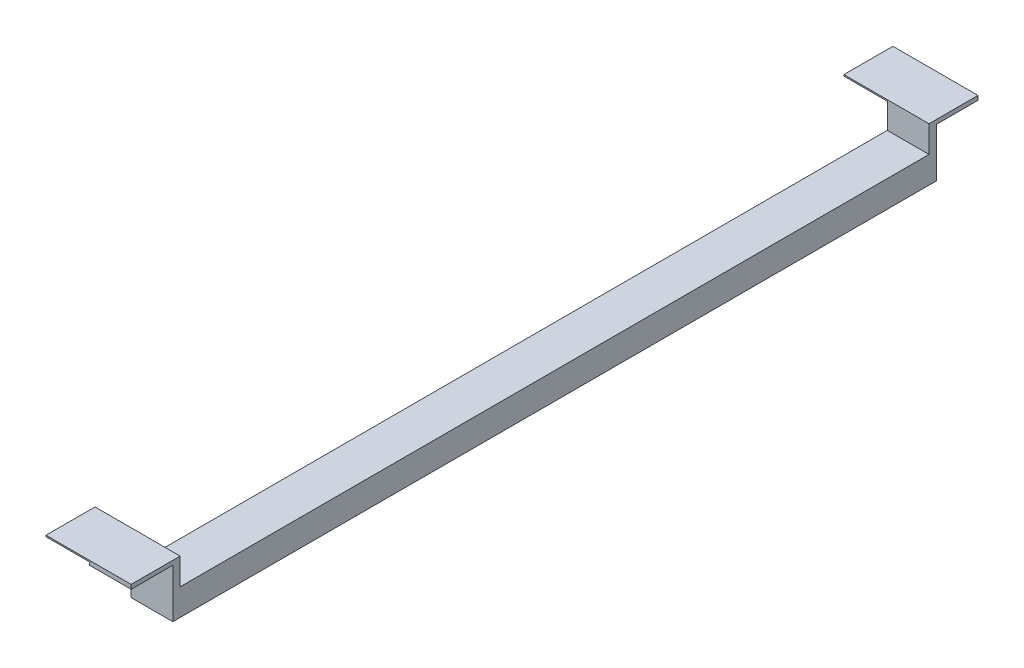
from build123d import *

# Parameters (mm, degrees)
SKETCH_2_W      = 98
SKETCH_2_H      = 98
EXTRUDE_1_DEPTH = 10
SKETCH_3_W      = 98
SKETCH_3_H      = 125
EXTRUDE_2_DEPTH = 10
SKETCH_4_W      = 98
SKETCH_4_H      = 62.5
EXTRUDE_3_DEPTH = 886.75
SKETCH_5_W      = 98
SKETCH_5_H      = 62.5
EXTRUDE_4_DEPTH = 7.1
SKETCH_6_W      = 98
SKETCH_6_H      = 62.5
EXTRUDE_5_DEPTH = 7.1
SKETCH_9_W      = 115.1
SKETCH_9_H      = 3.2
EXTRUDE_6_DEPTH = 102


with BuildPart() as part:
    # 草图2 → 凸台-拉伸1 (new body)
    with BuildSketch(Plane(origin=(0, 0, 0), x_dir=(1, 0, 0), z_dir=(0, 1, 0))):
        with Locations((34.507061985, 30.744472309)):
            Rectangle(SKETCH_2_W, SKETCH_2_H)
    extrude(amount=EXTRUDE_1_DEPTH)

    # 草图3 → 凸台-拉伸2 (add)
    with BuildSketch(Plane.XY.offset(18.255527691)):
        with Locations((34.507061985, -52.5)):
            Rectangle(SKETCH_3_W, SKETCH_3_H)
    extrude(amount=EXTRUDE_2_DEPTH)

    # 草图4 → 凸台-拉伸3 (add)
    with BuildSketch(Plane.XY.offset(28.255527691)):
        with Locations((34.507061985, -83.75)):
            Rectangle(SKETCH_4_W, SKETCH_4_H)
    extrude(amount=EXTRUDE_3_DEPTH)

    # 镜向4: part across plane


with BuildPart() as part_1:
    add(part.part)
    add(part.part.mirror(Plane.XY.offset(915.005527691)))

    # 草图5 → 凸台-拉伸4 (add)
    with BuildSketch(Plane.XY.offset(28.255527691)):
        with Locations((34.507061985, -21.25)):
            Rectangle(SKETCH_5_W, SKETCH_5_H)
    extrude(amount=EXTRUDE_4_DEPTH)

    # 草图6 → 凸台-拉伸5 (add)
    with BuildSketch(Plane(origin=(0, 0, 1801.755527691), x_dir=(-1, 0, 0), z_dir=(0, 0, -1))):
        with Locations((-34.507061985, -21.25)):
            Rectangle(SKETCH_6_W, SKETCH_6_H)
    extrude(amount=EXTRUDE_5_DEPTH)

    # 草图9 → 凸台-拉伸6 (add)
    with BuildSketch(Plane.ZY.offset(14.492938015)):
        with Locations((-22.194472309, 8.4)):
            Rectangle(SKETCH_9_W, SKETCH_9_H)
        with Locations((1852.205527691, 8.4)):
            Rectangle(SKETCH_9_W, SKETCH_9_H)
    extrude(amount=EXTRUDE_6_DEPTH)


solid = part_1.part
